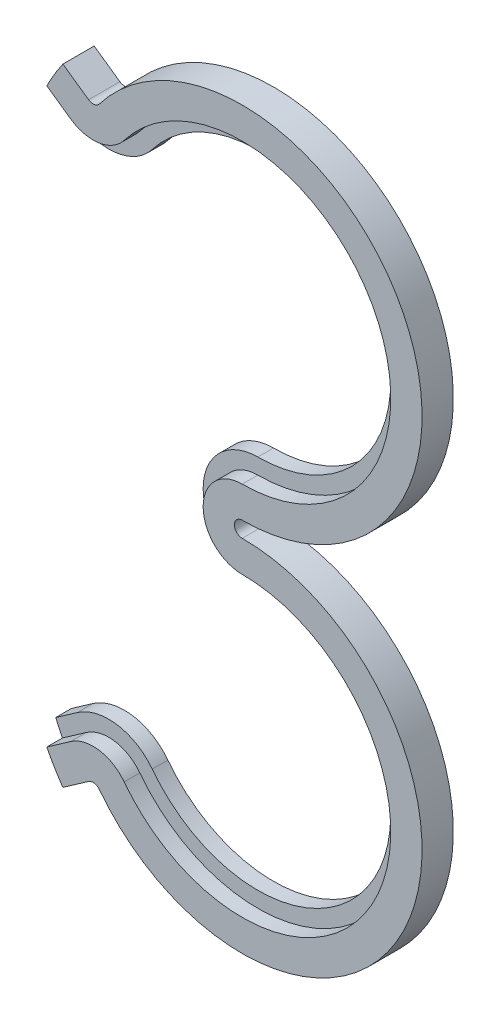
from build123d import *

# Parameters (mm, degrees)
BOSS_EXTRU_2_DEPTH      = 2
ENL_V_START             = -1
ENL_V_MAT_EXTRU_1_DEPTH = 1


with BuildPart() as part:
    # Esquisse1 → Boss.-Extru.2 (new body)
    with BuildSketch(Plane.XY):
        with BuildLine():
            Line((-12.922465041, 17.386083667), (-11.5420173, 16.419483753))
            ThreePointArc((-11.5420173, 16.419483753), (-8.998687611, 15.827772592), (-6.753604006, 17.161282102))
            ThreePointArc((-6.753604006, 17.161282102), (7.619740739, 15.766902052), (0, 3.5))
            ThreePointArc((0, 3.5), (-3.5, 0), (0, -3.5))
            ThreePointArc((0, -3.5), (7.619740739, -15.766902052), (-6.753604006, -17.161282102))
            ThreePointArc((-6.753604006, -17.161282102), (-8.998687611, -15.827772592), (-11.5420173, -16.419483753))
            Line((-11.5420173, -16.419483753), (-12.922465041, -17.386083667))
            ThreePointArc((-12.922465041, -17.386083667), (-12.266740841, -18.747374982), (-11.46812862, -20.030070109))
            Line((-11.46812862, -20.030070109), (-9.821287991, -18.876939886))
            ThreePointArc((-9.821287991, -18.876939886), (-9.457955178, -18.79240972), (-9.137228949, -18.982911079))
            ThreePointArc((-9.137228949, -18.982911079), (10.309061, -17.096396894), (0, -0.5))
            ThreePointArc((0, -0.5), (-0.5, 0), (0, 0.5))
            ThreePointArc((0, 0.5), (10.309061, 17.096396894), (-9.137228949, 18.982911079))
            ThreePointArc((-9.137228949, 18.982911079), (-9.457955178, 18.79240972), (-9.821287991, 18.876939886))
            Line((-9.821287991, 18.876939886), (-11.46812862, 20.030070109))
            ThreePointArc((-11.46812862, 20.030070109), (-12.266740841, 18.747374982), (-12.922465041, 17.386083667))
        make_face()
    extrude(amount=BOSS_EXTRU_2_DEPTH)

    # Esquisse2 → Enlèv. mat.-Extru.1 (cut)
    with BuildSketch(Plane.XY.offset(2).offset(ENL_V_START)):
        with BuildLine():
            Line((-12.922465041, 17.386083667), (-11.5420173, 16.419483753))
            ThreePointArc((-11.5420173, 16.419483753), (-8.998687611, 15.827772592), (-6.753604006, 17.161282102))
            ThreePointArc((-6.753604006, 17.161282102), (7.619740739, 15.766902052), (0, 3.5))
            ThreePointArc((0, 3.5), (-3.5, 0), (0, -3.5))
            ThreePointArc((0, -3.5), (7.619740739, -15.766902052), (-6.753604006, -17.161282102))
            ThreePointArc((-6.753604006, -17.161282102), (-8.998687611, -15.827772592), (-11.5420173, -16.419483753))
            Line((-11.5420173, -16.419483753), (-12.922465041, -17.386083667))
            Line((-12.922465041, -17.386083667), (-12.979954825, -18.647113037))
            Line((-12.979954825, -18.647113037), (-12.348888604, -18.205235712))
            Line((-12.348888604, -18.205235712), (-10.968440864, -17.238635798))
            ThreePointArc((-10.968440864, -17.238635798), (-9.1517768, -16.815984968), (-7.548145653, -17.768491761))
            ThreePointArc((-7.548145653, -17.768491761), (8.516180826, -16.210066999), (0, -2.5))
            ThreePointArc((0, -2.5), (-2.5, 0), (0, 2.5))
            ThreePointArc((0, 2.5), (8.516180826, 16.210066999), (-7.548145653, 17.768491761))
            ThreePointArc((-7.548145653, 17.768491761), (-9.1517768, 16.815984968), (-10.968440864, 17.238635798))
            Line((-10.968440864, 17.238635798), (-12.348888604, 18.205235712))
            Line((-12.348888604, 18.205235712), (-12.898926694, 18.590376529))
            Line((-12.898926694, 18.590376529), (-13.29562882, 18.205235712))
            Line((-13.29562882, 18.205235712), (-12.922465041, 17.386083667))
        make_face()
    extrude(amount=ENL_V_MAT_EXTRU_1_DEPTH, mode=Mode.SUBTRACT)


solid = part.part
